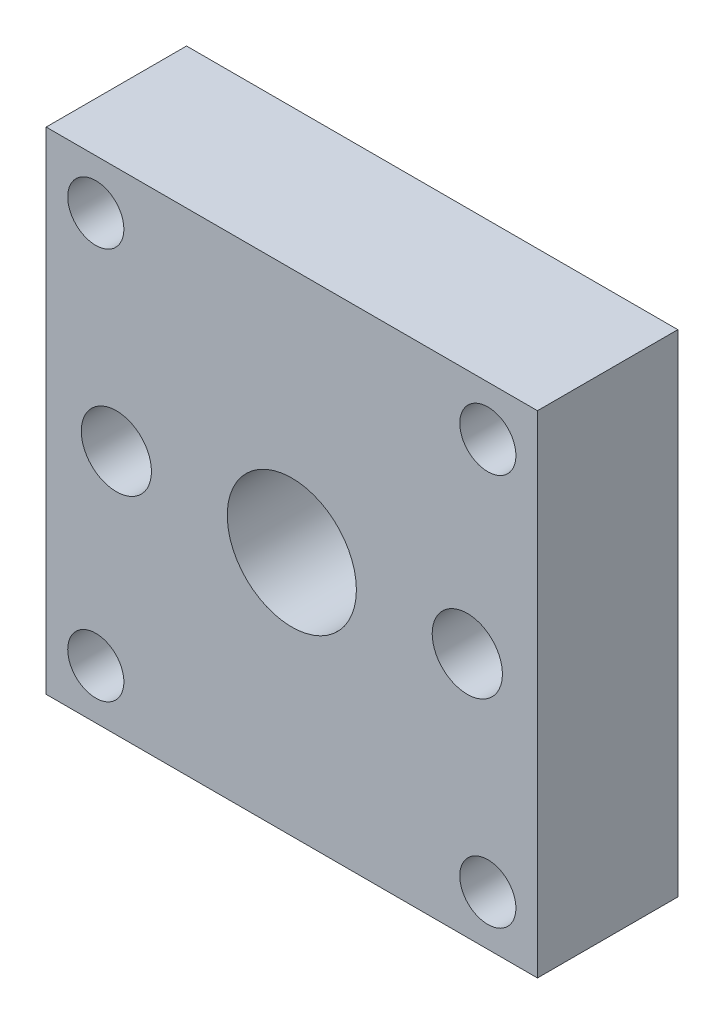
from build123d import *

# Parameters (mm, degrees)
SKETCH1_W           = 35
SKETCH1_H           = 35
SKETCH1_R           = 4.6
SKETCH1_R_2         = 2
SKETCH1_R_3         = 2.5
BOSS_EXTRUDE1_DEPTH = 10


with BuildPart() as part:
    # Sketch1 → Boss-Extrude1 (new body)
    with BuildSketch(Plane.XY):
        with Locations((8.031937938, -5.058807352)):
            Rectangle(SKETCH1_W, SKETCH1_H)
        with Locations((8.031937938, -5.058807352)):
            Circle(SKETCH1_R, mode=Mode.SUBTRACT)
        with Locations((21.996404032, -19.023273446)):
            Circle(SKETCH1_R_2, mode=Mode.SUBTRACT)
        with Locations(Location((21.996404032, 8.905658742, 0), (0, 0, 180))):
            Circle(SKETCH1_R_2, mode=Mode.SUBTRACT)
        with Locations(Location((-5.932528156, -19.023273446, 0), (0, 0, 180))):
            Circle(SKETCH1_R_2, mode=Mode.SUBTRACT)
        with Locations((-5.932528156, 8.905658742)):
            Circle(SKETCH1_R_2, mode=Mode.SUBTRACT)
        with Locations((-4.468062062, -5.058807352)):
            Circle(SKETCH1_R_3, mode=Mode.SUBTRACT)
        with Locations(Location((20.531937938, -5.058807352, 0), (0, 0, 180))):
            Circle(SKETCH1_R_3, mode=Mode.SUBTRACT)
    extrude(amount=BOSS_EXTRUDE1_DEPTH)


solid = part.part
